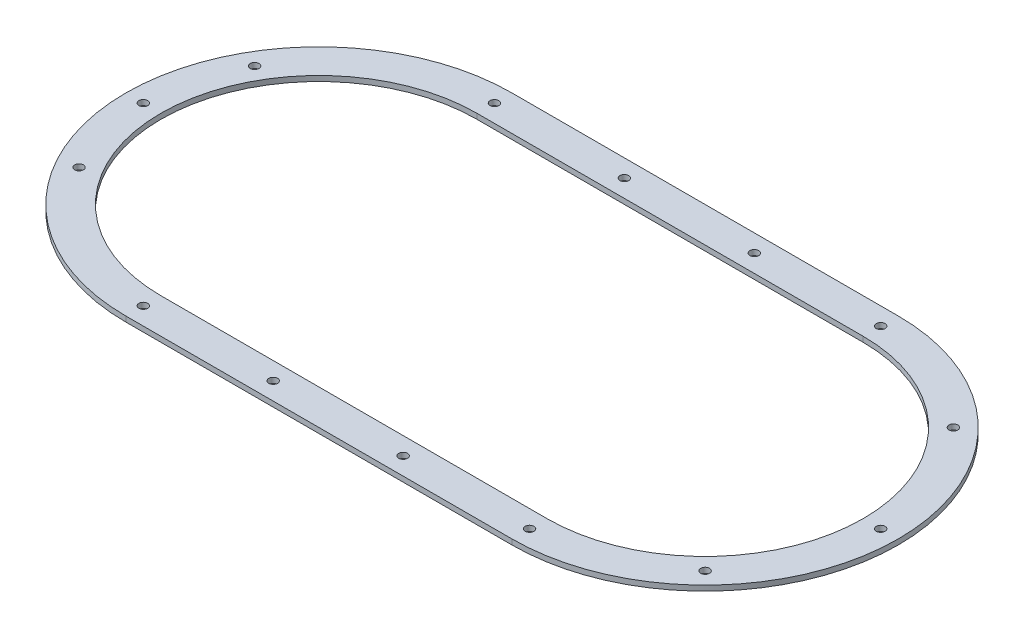
from build123d import *

# Parameters (mm, degrees)
ESBO_O1_R                = 2.5
RESSALTO_EXTRUS_O2_DEPTH = 3


with BuildPart() as part:
    # Esboço1 → Ressalto-extrusão2 (new body)
    with BuildSketch(Plane(origin=(0, 0, 0), x_dir=(1, 0, 0), z_dir=(0, 1, 0))):
        with BuildLine():
            Line((68.54446848, 235.010465991), (288.54446848, 235.010465991))
            ThreePointArc((288.54446848, 235.010465991), (398.54446848, 125.010465991), (288.54446848, 15.010465991))
            Line((288.54446848, 15.010465991), (68.54446848, 15.010465991))
            ThreePointArc((68.54446848, 15.010465991), (-41.45553152, 125.010465991), (68.54446848, 235.010465991))
        make_face()
        with Locations(Location((68.54446848, 225.010465991, 0), (0, 0, 270))):
            Circle(ESBO_O1_R, mode=Mode.SUBTRACT)
        with Locations(Location((68.54446848, 25.010465991, 0), (0, 0, 270))):
            Circle(ESBO_O1_R, mode=Mode.SUBTRACT)
        with Locations(Location((288.54446848, 25.010465991, 0), (0, 0, 270))):
            Circle(ESBO_O1_R, mode=Mode.SUBTRACT)
        with Locations(Location((288.54446848, 225.010465991, 0), (0, 0, 270))):
            Circle(ESBO_O1_R, mode=Mode.SUBTRACT)
        with Locations(Location((-18.058071899, 175.010465991, 0), (0, 0, 270))):
            Circle(ESBO_O1_R, mode=Mode.SUBTRACT)
        with Locations(Location((-31.45553152, 125.010465991, 0), (0, 0, 270))):
            Circle(ESBO_O1_R, mode=Mode.SUBTRACT)
        with Locations(Location((-18.058071899, 75.010465991, 0), (0, 0, 270))):
            Circle(ESBO_O1_R, mode=Mode.SUBTRACT)
        with Locations(Location((359.255146599, 54.299787872, 0), (0, 0, 270))):
            Circle(ESBO_O1_R, mode=Mode.SUBTRACT)
        with Locations(Location((388.54446848, 125.010465991, 0), (0, 0, 270))):
            Circle(ESBO_O1_R, mode=Mode.SUBTRACT)
        with Locations(Location((359.255146599, 195.72114411, 0), (0, 0, 270))):
            Circle(ESBO_O1_R, mode=Mode.SUBTRACT)
        with Locations(Location((142.54446848, 25.010465991, 0), (0, 0, 270))):
            Circle(ESBO_O1_R, mode=Mode.SUBTRACT)
        with Locations(Location((216.54446848, 25.010465991, 0), (0, 0, 270))):
            Circle(ESBO_O1_R, mode=Mode.SUBTRACT)
        with Locations(Location((142.54446848, 225.010465991, 0), (0, 0, 270))):
            Circle(ESBO_O1_R, mode=Mode.SUBTRACT)
        with Locations(Location((216.54446848, 225.010465991, 0), (0, 0, 270))):
            Circle(ESBO_O1_R, mode=Mode.SUBTRACT)
        with BuildLine():
            Line((68.54446848, 215.010465991), (288.54446848, 215.010465991))
            ThreePointArc((288.54446848, 215.010465991), (378.54446848, 125.010465991), (288.54446848, 35.010465991))
            Line((288.54446848, 35.010465991), (68.54446848, 35.010465991))
            ThreePointArc((68.54446848, 35.010465991), (-21.45553152, 125.010465991), (68.54446848, 215.010465991))
        make_face(mode=Mode.SUBTRACT)
    extrude(amount=RESSALTO_EXTRUS_O2_DEPTH)


solid = part.part
